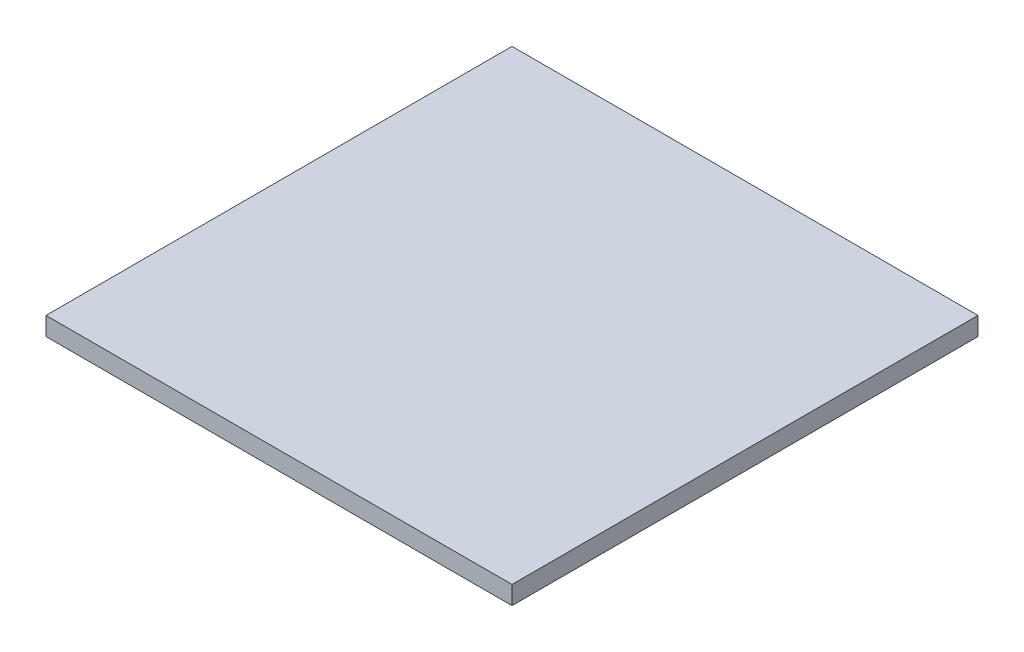
from build123d import *

# Parameters (mm, degrees)
SKETCH1_W           = 76.2
SKETCH1_H           = 76.2
BOSS_EXTRUDE1_DEPTH = 3


with BuildPart() as part:
    # Sketch1 → Boss-Extrude1 (new body)
    with BuildSketch(Plane(origin=(0, 0, 0), x_dir=(1, 0, 0), z_dir=(0, 1, 0))):
        Rectangle(SKETCH1_W, SKETCH1_H)
    extrude(amount=-BOSS_EXTRUDE1_DEPTH)


solid = part.part
